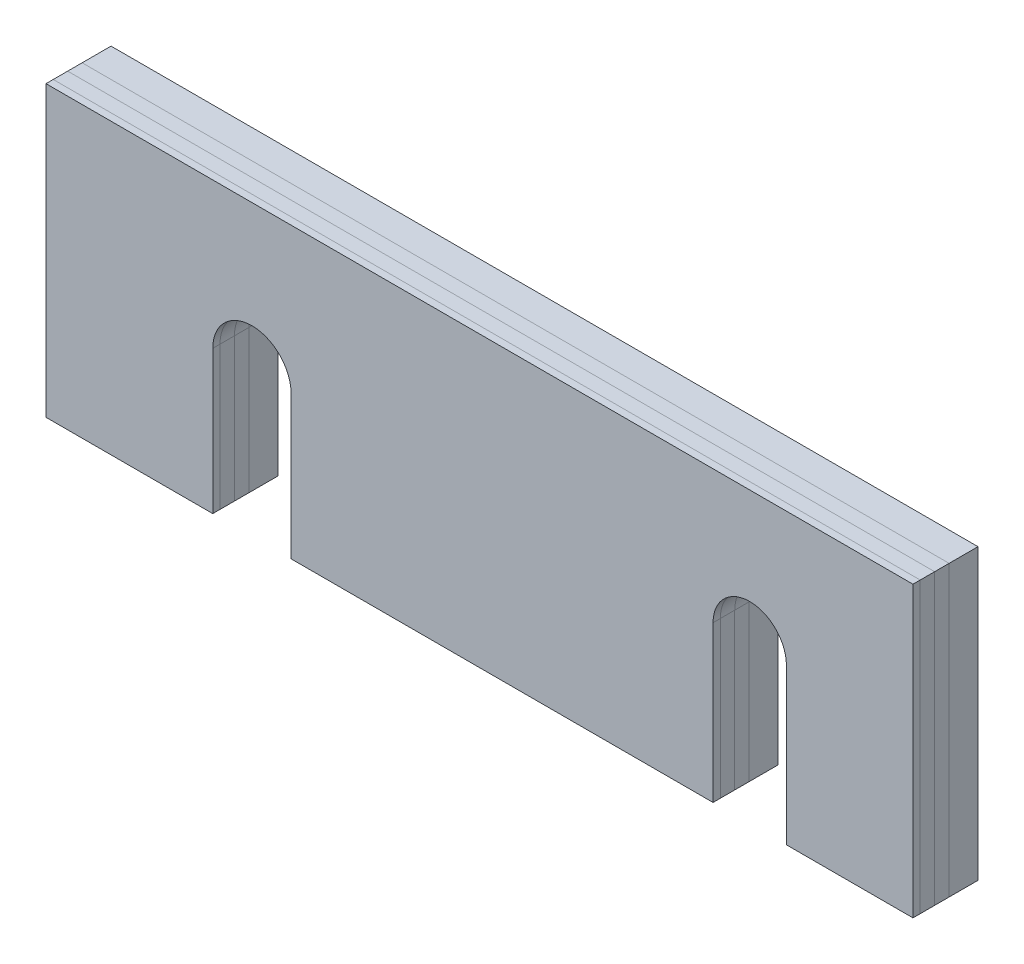
from build123d import *

# Parameters (mm, degrees)
BOSS_EXTRUDE1_DEPTH = 1
BOSS_EXTRUDE2_DEPTH = 0.5
BOSS_EXTRUDE3_DEPTH = 0.5
BOSS_EXTRUDE4_DEPTH = 0.25


with BuildPart() as part:
    # Sketch1 → Boss-Extrude1 (new body)
    with BuildSketch(Plane.XY):
        with BuildLine():
            Line((-13.035921205, -3.725376593), (-13.035921205, 6.274623407))
            Line((-13.035921205, 6.274623407), (16.964078795, 6.274623407))
            Line((16.964078795, 6.274623407), (16.964078795, -3.725376593))
            Line((16.964078795, -3.725376593), (12.58400927, -3.725376593))
            Line((12.58400927, -3.725376593), (12.58400927, 1.662804171))
            ThreePointArc((12.58400927, 1.662804171), (11.315179606, 2.931633835), (10.046349942, 1.662804171))
            Line((10.046349942, 1.662804171), (10.046349942, -3.725376593))
            Line((10.046349942, -3.725376593), (-4.553881808, -3.725376593))
            Line((-4.553881808, -3.725376593), (-4.553881808, 1.228273465))
            ThreePointArc((-4.553881808, 1.228273465), (-5.909617613, 2.58400927), (-7.265353418, 1.228273465))
            Line((-7.265353418, 1.228273465), (-7.265353418, -3.725376593))
            Line((-7.265353418, -3.725376593), (-13.035921205, -3.725376593))
        make_face()
    extrude(amount=BOSS_EXTRUDE1_DEPTH)


with BuildPart() as body_2:
    # Sketch2 → Boss-Extrude2 (new body)
    with BuildSketch(Plane.XY.offset(1)):
        with BuildLine():
            Line((-13.035921205, -3.725376593), (-7.265353418, -3.725376593))
            Line((-7.265353418, -3.725376593), (-7.265353418, 1.228273465))
            ThreePointArc((-7.265353418, 1.228273465), (-5.909617613, 2.58400927), (-4.553881808, 1.228273465))
            Line((-4.553881808, 1.228273465), (-4.553881808, -3.725376593))
            Line((-4.553881808, -3.725376593), (10.046349942, -3.725376593))
            Line((10.046349942, -3.725376593), (10.046349942, 1.662804171))
            ThreePointArc((10.046349942, 1.662804171), (11.315179606, 2.931633835), (12.58400927, 1.662804171))
            Line((12.58400927, 1.662804171), (12.58400927, -3.725376593))
            Line((12.58400927, -3.725376593), (16.964078795, -3.725376593))
            Line((16.964078795, -3.725376593), (16.964078795, 6.274623407))
            Line((16.964078795, 6.274623407), (-13.035921205, 6.274623407))
            Line((-13.035921205, 6.274623407), (-13.035921205, -3.725376593))
        make_face()
    extrude(amount=BOSS_EXTRUDE2_DEPTH)


with BuildPart() as body_3:
    # Sketch3 → Boss-Extrude3 (new body)
    with BuildSketch(Plane.XY.offset(1.5)):
        with BuildLine():
            Line((-13.035921205, 6.274623407), (-13.035921205, -3.725376593))
            Line((-13.035921205, -3.725376593), (-7.265353418, -3.725376593))
            Line((-7.265353418, -3.725376593), (-7.265353418, 1.228273465))
            ThreePointArc((-7.265353418, 1.228273465), (-5.909617613, 2.58400927), (-4.553881808, 1.228273465))
            Line((-4.553881808, 1.228273465), (-4.553881808, -3.725376593))
            Line((-4.553881808, -3.725376593), (10.046349942, -3.725376593))
            Line((10.046349942, -3.725376593), (10.046349942, 1.662804171))
            ThreePointArc((10.046349942, 1.662804171), (11.315179606, 2.931633835), (12.58400927, 1.662804171))
            Line((12.58400927, 1.662804171), (12.58400927, -3.725376593))
            Line((12.58400927, -3.725376593), (16.964078795, -3.725376593))
            Line((16.964078795, -3.725376593), (16.964078795, 6.274623407))
            Line((16.964078795, 6.274623407), (-13.035921205, 6.274623407))
        make_face()
    extrude(amount=BOSS_EXTRUDE3_DEPTH)


with BuildPart() as body_4:
    # Sketch4 → Boss-Extrude4 (new body)
    with BuildSketch(Plane.XY.offset(2)):
        with BuildLine():
            Line((16.964078795, 6.274623407), (-13.035921205, 6.274623407))
            Line((-13.035921205, 6.274623407), (-13.035921205, -3.725376593))
            Line((-13.035921205, -3.725376593), (-7.265353418, -3.725376593))
            Line((-7.265353418, -3.725376593), (-7.265353418, 1.228273465))
            ThreePointArc((-7.265353418, 1.228273465), (-5.909617613, 2.58400927), (-4.553881808, 1.228273465))
            Line((-4.553881808, 1.228273465), (-4.553881808, -3.725376593))
            Line((-4.553881808, -3.725376593), (10.046349942, -3.725376593))
            Line((10.046349942, -3.725376593), (10.046349942, 1.662804171))
            ThreePointArc((10.046349942, 1.662804171), (11.315179606, 2.931633835), (12.58400927, 1.662804171))
            Line((12.58400927, 1.662804171), (12.58400927, -3.725376593))
            Line((12.58400927, -3.725376593), (16.964078795, -3.725376593))
            Line((16.964078795, -3.725376593), (16.964078795, 6.274623407))
        make_face()
    extrude(amount=BOSS_EXTRUDE4_DEPTH)


solid = Compound([part.part, body_2.part, body_3.part, body_4.part])
